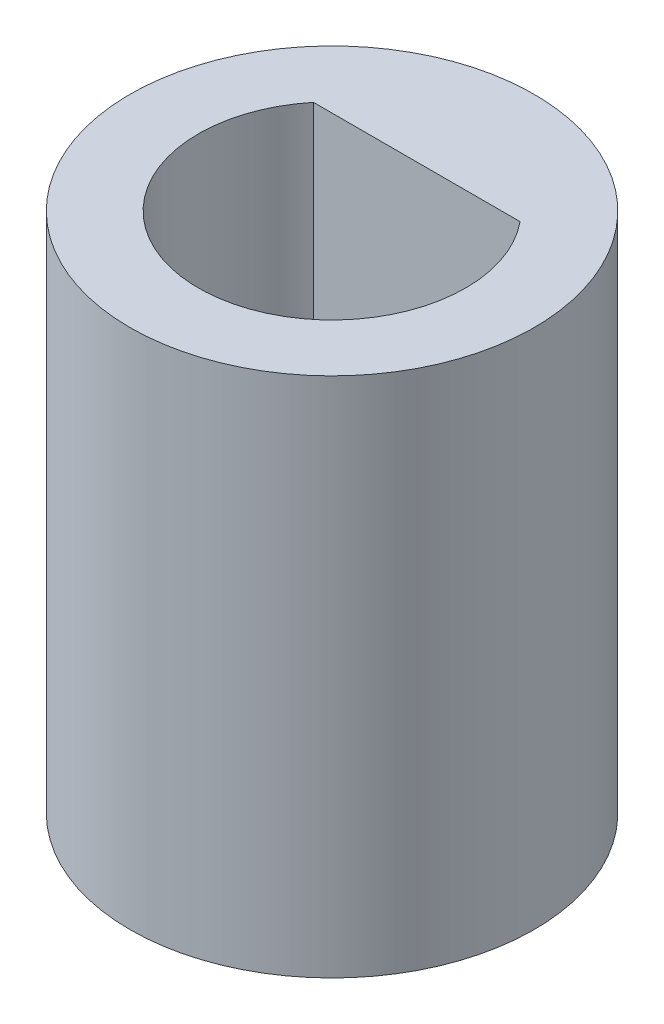
from build123d import *

# Parameters (mm, degrees)
SKETCH1_R           = 3.1
BOSS_EXTRUDE1_DEPTH = 8


with BuildPart() as part:
    # Sketch1 → Boss-Extrude1 (new body)
    with BuildSketch(Plane(origin=(0, 0, 0), x_dir=(1, 0, 0), z_dir=(0, 1, 0))):
        with Locations(Location((0, 0, 0), (0, 0, 270))):
            Circle(SKETCH1_R)
        with BuildLine():
            Line((-1.585086748, 1.3), (1.585086748, 1.3))
            ThreePointArc((1.585086748, 1.3), (0, -2.05), (-1.585086748, 1.3))
        make_face(mode=Mode.SUBTRACT)
    extrude(amount=BOSS_EXTRUDE1_DEPTH)


solid = part.part
